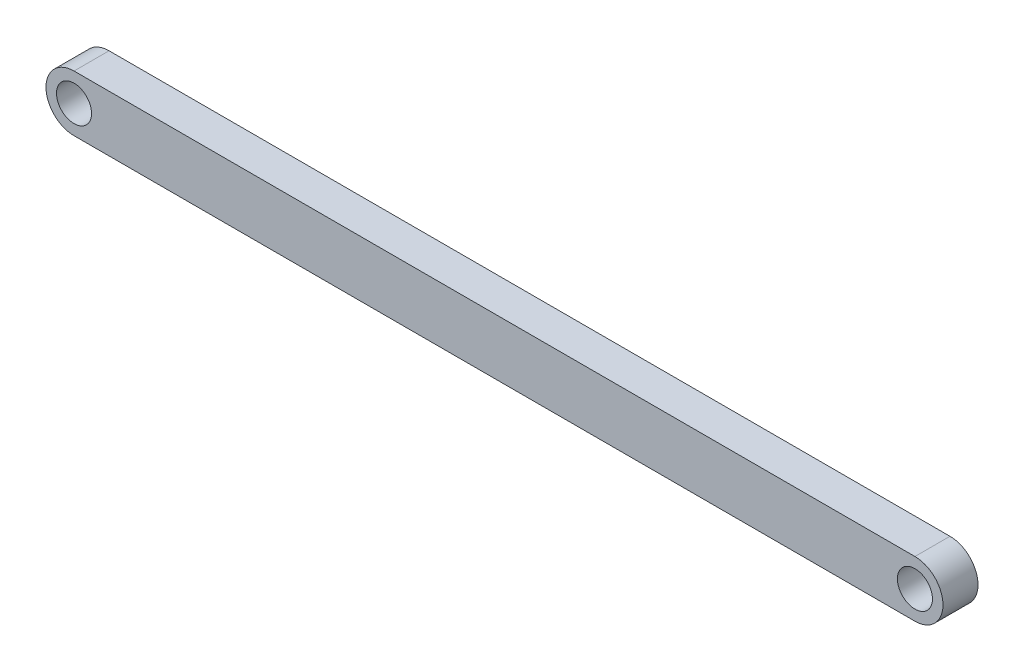
from build123d import *

# Parameters (mm, degrees)
SKETCH1_R           = 5
BOSS_EXTRUDE1_DEPTH = 10


with BuildPart() as part:
    # Sketch1 → Boss-Extrude1 (new body)
    with BuildSketch(Plane.XY):
        with BuildLine():
            Line((0, 8), (240, 8))
            ThreePointArc((240, 8), (248, 0), (240, -8))
            Line((240, -8), (0, -8))
            ThreePointArc((0, -8), (-8, 0), (0, 8))
        make_face()
        with Locations((240, 0)):
            Circle(SKETCH1_R, mode=Mode.SUBTRACT)
        Circle(SKETCH1_R, mode=Mode.SUBTRACT)
    extrude(amount=BOSS_EXTRUDE1_DEPTH)


solid = part.part
